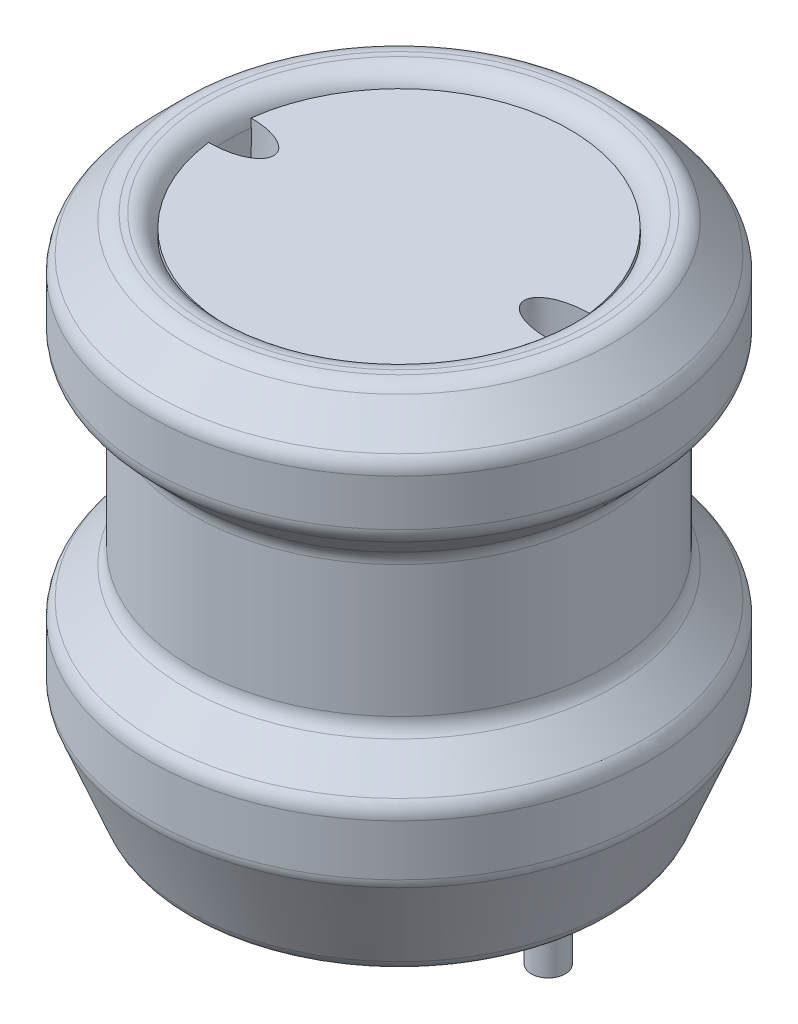
from build123d import *

# Parameters (mm, degrees)
EXTRUDE_START     = -0.5
SKETCH_1_R        = 0.4
EXTRUDE_1_DEPTH   = 1.5
EXTRUDE_1_2_DEPTH = 1.5
EXTRUDE_START_2   = -2
SKETCH_5_R        = 4
EXTRUDE_2_DEPTH   = 3
SKETCH_6_R        = 4
EXTRUDE_3_DEPTH   = 1.7
EXTRUDE_START_3   = -1.5
EXTRUDE_4_DEPTH   = 1.7
EXTRUDE_4_2_DEPTH = 1.7
FILLET_1_R        = 0.5


with BuildPart() as part:
    # Эскиз1 → Бобышка-Вытянуть1 (new body)
    with BuildSketch(Plane(origin=(0, 0, 0), x_dir=(1, 0, 0), z_dir=(0, 1, 0)).offset(EXTRUDE_START)):
        with Locations(Location((-3.5, 0, 0), (0, 0, 270))):
            Circle(SKETCH_1_R)
    extrude(amount=EXTRUDE_1_DEPTH)


with BuildPart() as body_2:
    # Эскиз1 → Extrude 1 2 (new body)
    with BuildSketch(Plane(origin=(0, 0, 0), x_dir=(1, 0, 0), z_dir=(0, 1, 0)).offset(EXTRUDE_START)):
        with Locations(Location((3.5, 0, 0), (0, 0, 270))):
            Circle(SKETCH_1_R)
    extrude(amount=EXTRUDE_1_2_DEPTH)


with BuildPart() as body_3:
    # Эскиз3 → Повернуть1 (revolve)
    with BuildSketch(Plane.XY, mode=Mode.PRIVATE) as revolve_1_sk:
        Polygon((0, 13), (-4.85, 13), (-5.85, 12), (-5.85, 10.5), (-4.85, 9.5), (-4.85, 6), (-5.85, 5), (-5.85, 3.5), (-4.85, 1), (0, 1), align=None)
    revolve(revolve_1_sk.sketch.rotate(Axis((0, 1, 0), (0, 1, 0)), 270), axis=Axis((0, 1, 0), (0, 1, 0)))


with BuildPart() as body_4:
    # Эскиз5 → Бобышка-Вытянуть2 (new body)
    with BuildSketch(Plane(origin=(0, 13, 0), x_dir=(1, 0, 0), z_dir=(0, 1, 0)).offset(EXTRUDE_START_2)):
        with Locations(Location((0, 0, 0), (0, 0, 270))):
            Circle(SKETCH_5_R)
    extrude(amount=EXTRUDE_2_DEPTH)


with BuildPart() as body_3_1:
    add(body_3.part)

    # Combine 1: cut body 4
    add(body_4.part, mode=Mode.SUBTRACT)

    # Скругление1
    fillet_1_edges = [body_3_1.edges().sort_by_distance(p)[0] for p in [
        (0, 12, 5.85),
        (0, 13, 4.85),
        (0, 13, -4),
        (0, 1, 4.85),
        (0, 3.5, 5.85),
        (0, 5, 5.85),
        (0, 6, 4.85),
        (0, 9.5, 4.85),
        (0, 10.5, 5.85),
    ]]
    fillet(fillet_1_edges, radius=FILLET_1_R)


with BuildPart() as body_4_2:
    # Эскиз6 → Бобышка-Вытянуть3 (new body)
    with BuildSketch(Plane(origin=(0, 11, 0), x_dir=(1, 0, 0), z_dir=(0, 1, 0))):
        with Locations(Location((0, 0, 0), (0, 0, 90))):
            Circle(SKETCH_6_R)
    extrude(amount=EXTRUDE_3_DEPTH)


with BuildPart() as body_5:
    # Эскиз7 → Бобышка-Вытянуть4 (new body)
    with BuildSketch(Plane(origin=(0, 12.7, 0), x_dir=(1, 0, 0), z_dir=(0, 1, 0)).offset(EXTRUDE_START_3)):
        with BuildLine():
            Line((-4, 0.5), (-4, -0.5))
            add(Edge.make_bspline(
                [(-4, 0.5), (-3, 0.5), (-2.5, 0), (-3, -0.5), (-4, -0.5)],
                knots=[0, 0, 0, 0, 0, 1, 1, 1, 1, 1], degree=4))
        make_face()
    extrude(amount=EXTRUDE_4_DEPTH)


with BuildPart() as body_6:
    # Эскиз7 → Extrude 4 2 (new body)
    with BuildSketch(Plane(origin=(0, 12.7, 0), x_dir=(1, 0, 0), z_dir=(0, 1, 0)).offset(EXTRUDE_START_3)):
        with BuildLine():
            Line((4, 0.5), (4, -0.5))
            add(Edge.make_bspline(
                [(4, 0.5), (3, 0.5), (2.5, 0), (3, -0.5), (4, -0.5)],
                knots=[0, 0, 0, 0, 0, 1, 1, 1, 1, 1], degree=4))
        make_face()
    extrude(amount=EXTRUDE_4_2_DEPTH)


with BuildPart() as body_4_2_1:
    add(body_4_2.part)

    # Combine 2: cut body 5, body 6
    add(body_5.part, mode=Mode.SUBTRACT)
    add(body_6.part, mode=Mode.SUBTRACT)


solid = Compound([part.part, body_2.part, body_3_1.part, body_4_2_1.part])
